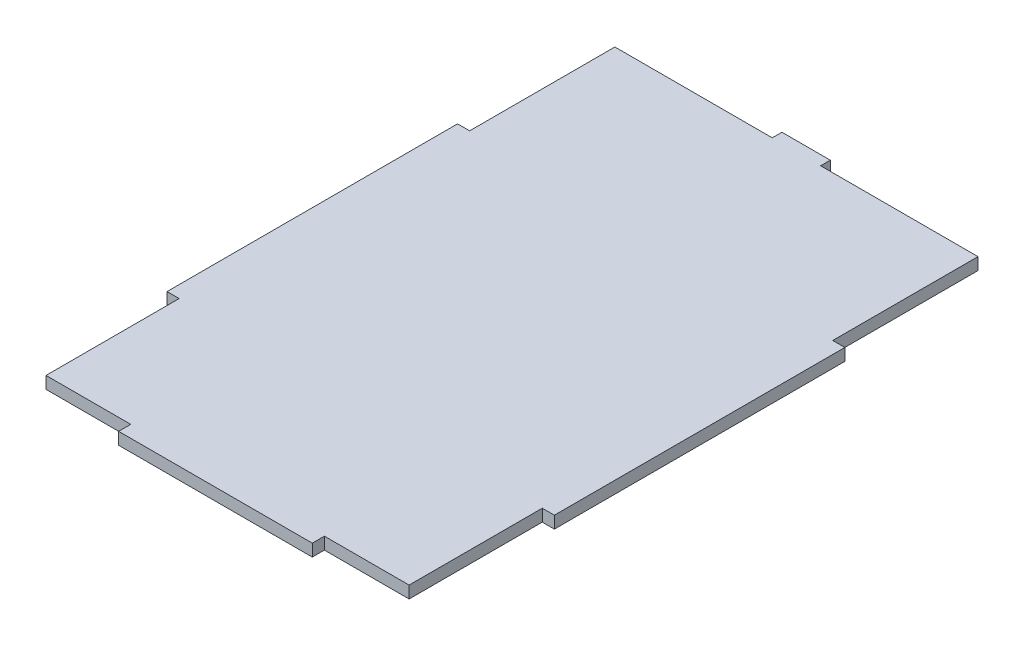
from build123d import *

# Parameters (mm, degrees)
SKETCH1_W           = 203.2
SKETCH1_H           = 304.8
BOSS_EXTRUDE1_DEPTH = 6.35
SKETCH2_W           = 6.35
SKETCH2_H           = 76.2
CUT_EXTRUDE1_DEPTH  = 6.35
SKETCH3_W           = 25.4
SKETCH3_H           = 5.08
BOSS_EXTRUDE3_DEPTH = 6.35
SKETCH5_W           = 44.45
SKETCH5_H           = 6.35
CUT_EXTRUDE2_DEPTH  = 6.35


with BuildPart() as part:
    # Sketch1 → Boss-Extrude1 (new body)
    with BuildSketch(Plane(origin=(0, 0, 0), x_dir=(1, 0, 0), z_dir=(0, 1, 0))):
        with Locations((70.689276808, 40.918703242)):
            Rectangle(SKETCH1_W, SKETCH1_H)
    extrude(amount=BOSS_EXTRUDE1_DEPTH)

    # Sketch2 → Cut-Extrude1 (cut)
    with BuildSketch(Plane(origin=(0, 6.35, 0), x_dir=(1, 0, 0), z_dir=(0, 1, 0))):
        with Locations((-27.735723192, -73.381296758)):
            Rectangle(SKETCH2_W, SKETCH2_H)
        with Locations((-27.735723192, 155.218703242)):
            Rectangle(SKETCH2_W, SKETCH2_H)
        with Locations((169.114276808, 155.218703242)):
            Rectangle(SKETCH2_W, SKETCH2_H)
        with Locations((169.114276808, -73.381296758)):
            Rectangle(SKETCH2_W, SKETCH2_H)
    extrude(amount=-CUT_EXTRUDE1_DEPTH, mode=Mode.SUBTRACT)

    # Sketch3 → Boss-Extrude3 (add)
    with BuildSketch(Plane(origin=(0, 6.35, 0), x_dir=(1, 0, 0), z_dir=(0, 1, 0))):
        with Locations((70.689276808, 195.858703242)):
            Rectangle(SKETCH3_W, SKETCH3_H)
    extrude(amount=-BOSS_EXTRUDE3_DEPTH)

    # Sketch5 → Cut-Extrude2 (cut)
    with BuildSketch(Plane(origin=(0, 6.35, 0), x_dir=(1, 0, 0), z_dir=(0, 1, 0))):
        with Locations((-2.335723192, -108.306296758)):
            Rectangle(SKETCH5_W, SKETCH5_H)
        with Locations((143.714276808, -108.306296758)):
            Rectangle(SKETCH5_W, SKETCH5_H)
    extrude(amount=-CUT_EXTRUDE2_DEPTH, mode=Mode.SUBTRACT)


solid = part.part
